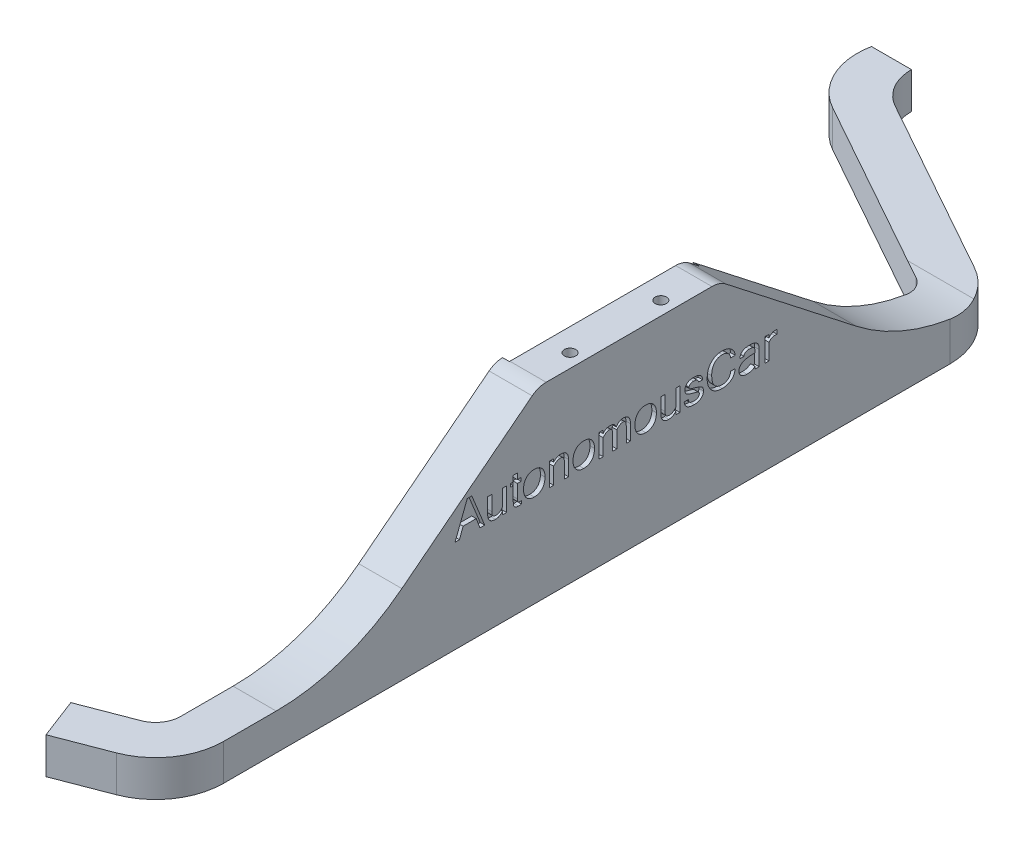
from build123d import *

# Parameters (mm, degrees)
BOSS_EXTRU_2_DEPTH      = 41
ENL_V_START             = -61.496999
ENL_V_MAT_EXTRU_1_DEPTH = 61.496999
ESQUISSE3_R             = 1.25
ENL_V_MAT_EXTRU_2_DEPTH = 5
ENL_V_MAT_EXTRU_4_REACH = 145.004
ESQUISSE5_W             = 1.5
ESQUISSE5_H             = 42
ESQUISSE4_R             = 1.25
ENL_V_MAT_EXTRU_3_DEPTH = 5
ENL_V_MAT_EXTRU_5_DEPTH = 1
ESQUISSE8_RX            = 2
ESQUISSE8_RY            = 1.909090909
ESQUISSE8_RX_2          = 2.047405919
ESQUISSE8_RY_2          = 1.246821368
ENL_V_MAT_EXTRU_6_DEPTH = 1


with BuildPart() as part:
    # Esquisse1 → Boss.-Extru.2 (new body)
    with BuildSketch(Plane(origin=(0, 0, 0), x_dir=(1, 0, 0), z_dir=(0, 1, 0))):
        with BuildLine():
            Line((50.763559857, -98.740960781), (61.966654671, -94.440883272))
            ThreePointArc((61.966654671, -94.440883272), (64.531491929, -92.419022685), (65.5, -89.3))
            Line((65.5, -89.3), (65.5, 70.7))
            ThreePointArc((65.5, 70.7), (64.743593506, 73.483580545), (62.682428855, 75.501518035))
            Line((62.682428855, 75.501518035), (21.187286271, 98.683304924))
            ThreePointArc((21.187286271, 98.683304924), (14.89615211, 105.465379036), (13.780150118, 114.648485147))
            Line((13.780150118, 114.648485147), (22.592211018, 114.648485147))
            ThreePointArc((22.592211018, 114.648485147), (23.967495552, 109.587429612), (27.715067645, 105.918452357))
            Line((27.715067645, 105.918452357), (67.31571506, 83.795049185))
            ThreePointArc((67.31571506, 83.795049185), (72.937073199, 78.291583303), (75, 70.7))
            Line((75, 70.7), (75, -89.3))
            ThreePointArc((75, -89.3), (72.360609576, -97.8), (65.370882699, -103.31))
            Line((65.370882699, -103.31), (54.167787884, -107.610077509))
            Line((54.167787884, -107.610077509), (50.763559857, -98.740960781))
        make_face()
    extrude(amount=BOSS_EXTRU_2_DEPTH)

    # Esquisse2 → Enlèv. mat.-Extru.1 (cut)
    with BuildSketch(Plane(origin=(75, 0, 0), x_dir=(0, 0, -1), z_dir=(1, 0, 0)).offset(ENL_V_START)):
        with BuildLine():
            Line((-107.610077509, 8), (-77.729988546, 8))
            ThreePointArc((-77.729988546, 8), (-63.08996569, 10.448034936), (-50.042800053, 17.525789743))
            Line((-50.042800053, 17.525789743), (-21.322570174, 39.941578917))
            ThreePointArc((-21.322570174, 39.941578917), (-19.872885103, 40.727996118), (-18.246215897, 41))
            Line((-18.246215897, 41), (18.279747735, 41))
            ThreePointArc((18.279747735, 41), (19.906416941, 40.727996118), (21.356102012, 39.941578917))
            Line((21.356102012, 39.941578917), (50.076331892, 17.525789743))
            ThreePointArc((50.076331892, 17.525789743), (63.123497529, 10.448034936), (77.763520385, 8))
            Line((77.763520385, 8), (114.648485147, 8))
            Line((114.648485147, 8), (114.648485147, 51.491997176))
            Line((114.648485147, 51.491997176), (-107.610077509, 51.491997176))
            Line((-107.610077509, 51.491997176), (-107.610077509, 8))
        make_face()
    extrude(amount=ENL_V_MAT_EXTRU_1_DEPTH, mode=Mode.SUBTRACT)

    # Esquisse3 → Enlèv. mat.-Extru.2 (cut)
    with BuildSketch(Plane.XZ):
        with Locations(Location((72, 11.001514853, 0), (0, 0, 270))):
            Circle(ESQUISSE3_R)
        with Locations(Location((72, -39.078485147, 0), (0, 0, 270))):
            Circle(ESQUISSE3_R)
        with Locations(Location((63.03, 98.921514853, 0), (0, 0, 270))):
            Circle(ESQUISSE3_R)
        with Locations(Location((65.848788278, -79.175234258, 0), (0, 0, 270))):
            Circle(ESQUISSE3_R)
        with Locations(Location((26.642211018, -101.078485147, 0), (0, 0, 270))):
            Circle(ESQUISSE3_R)
        with Locations(Location((72, 61.081514853, 0), (0, 0, 270))):
            Circle(ESQUISSE3_R)
    extrude(amount=-ENL_V_MAT_EXTRU_2_DEPTH, mode=Mode.SUBTRACT)

    # Enlèv. mat.-Extru.4: up to this face of the body (flat: up to its plane)
    enl_v_mat_extru_4_end = Plane(part.part.faces().sort_by_distance((70.25, 41, -0.016765919))[0])
    # Esquisse5 → Enlèv. mat.-Extru.4 (cut, up to the picked face)
    with BuildSketch(Plane.XZ, mode=Mode.PRIVATE) as enl_v_mat_extru_4_sk1:
        with Locations((66.25, -2.648485147)):
            Rectangle(ESQUISSE5_W, ESQUISSE5_H)
    enl_v_mat_extru_4_tool1 = split(extrude(enl_v_mat_extru_4_sk1.sketch, amount=-ENL_V_MAT_EXTRU_4_REACH, mode=Mode.PRIVATE), bisect_by=enl_v_mat_extru_4_end, keep=Keep.BOTH, mode=Mode.PRIVATE)
    add(enl_v_mat_extru_4_tool1.solids().sort_by(Axis((66.25, 0, -2.648485), (0, 1, 0)))[0], mode=Mode.SUBTRACT)

    # Esquisse4 → Enlèv. mat.-Extru.3 (cut)
    with BuildSketch(Plane(origin=(0, 41, 0), x_dir=(1, 0, 0), z_dir=(0, 1, 0))):
        with Locations(Location((72, 10.016765919, 0), (0, 0, 270))):
            Circle(ESQUISSE4_R)
        with Locations(Location((72, -9.983234081, 0), (0, 0, 90))):
            Circle(ESQUISSE4_R)
    extrude(amount=-ENL_V_MAT_EXTRU_3_DEPTH, mode=Mode.SUBTRACT)

    # Esquisse7 → Enlèv. mat.-Extru.5 (cut)
    # profile 1 of 13: a face of its own
    with BuildSketch(Plane(origin=(75, 0, 0), x_dir=(0, 0, -1), z_dir=(1, 0, 0))):
        Polygon((-31.777547707, 20.5), (-32.828684071, 20.5), (-33.656809071, 22.681818182), (-36.555956798, 22.681818182), (-37.341468162, 20.5), (-38.323002252, 20.5), (-35.632661343, 27.5), (-34.634081798, 27.5), align=None)
        Polygon((-33.930956798, 23.409090909), (-35.14402498, 26.606534091), (-36.294593162, 23.409090909), align=None, mode=Mode.SUBTRACT)
    # profile 2 of 13: a face of its own
    with BuildSketch(Plane(origin=(75, 0, 0), x_dir=(0, 0, -1), z_dir=(1, 0, 0))):
        with BuildLine():
            add(Edge.make_bspline(
                [(-27.868456798, 21.171875), (-27.925128165, 21.111107173), (-28.035633549, 20.992613966), (-28.215593571, 20.837728714), (-28.399901536, 20.705758003), (-28.588986373, 20.596313907), (-28.785501819, 20.513639299), (-28.986510447, 20.454158924), (-29.192677339, 20.414718249), (-29.332292665, 20.410974686), (-29.402547707, 20.409090909)],
                knots=[0, 0, 0, 0, 1.127828388, 2.199190093, 3.218086356, 4.203140575, 5.159827852, 6.105909572, 7.046885413, 8, 8, 8, 8], degree=3))
            add(Edge.make_bspline(
                [(-29.402547707, 20.409090909), (-29.472701093, 20.41019445), (-29.609139026, 20.412340673), (-29.806543574, 20.436351193), (-29.990931329, 20.470415644), (-30.16157157, 20.521673499), (-30.318055654, 20.589205739), (-30.463234951, 20.668035048), (-30.593109645, 20.76419223), (-30.709691657, 20.874745181), (-30.811648331, 21.000190272), (-30.901063025, 21.139442754), (-30.974662991, 21.294438415), (-31.035048056, 21.463565137), (-31.083946042, 21.646811827), (-31.117353391, 21.845088905), (-31.136982907, 22.057839578), (-31.139758511, 22.204502826), (-31.141184071, 22.279829545)],
                knots=[0, 0, 0, 0, 1.149030253, 2.23469346, 3.254265501, 4.218948563, 5.147116777, 6.043205733, 6.920039969, 7.787208019, 8.669450004, 9.562712599, 10.492792392, 11.474580383, 12.502210548, 13.596710759, 14.765662847, 16, 16, 16, 16], degree=3))
            Line((-31.141184071, 22.279829545), (-31.141184071, 25.590909091))
            Line((-31.141184071, 25.590909091), (-30.232093162, 25.590909091))
            Line((-30.232093162, 25.590909091), (-30.232093162, 22.305397727))
            add(Edge.make_bspline(
                [(-30.232093162, 22.305397727), (-30.23188718, 22.255175928), (-30.231490164, 22.158376495), (-30.218946958, 22.018619986), (-30.203139232, 21.889864126), (-30.178813744, 21.772077364), (-30.147683737, 21.665115704), (-30.110223774, 21.568477183), (-30.064022453, 21.483309068), (-30.011290098, 21.40870429), (-29.95060024, 21.34315897), (-29.880084839, 21.287358713), (-29.800004758, 21.240656847), (-29.711264955, 21.202231764), (-29.614037158, 21.172527131), (-29.507946767, 21.151390174), (-29.392446269, 21.13856742), (-29.312146835, 21.137116917), (-29.270445434, 21.136363636)],
                knots=[0, 0, 0, 0, 1.373336941, 2.647022626, 3.836014541, 4.920805023, 5.933267669, 6.881014996, 7.750458455, 8.577164573, 9.374527885, 10.185764868, 11.027755585, 11.903736305, 12.825636, 13.803704939, 14.859411894, 16, 16, 16, 16], degree=3))
            add(Edge.make_bspline(
                [(-29.270445434, 21.136363636), (-29.207288968, 21.138849429), (-29.080763147, 21.143829394), (-28.893716866, 21.183486664), (-28.711553594, 21.248928606), (-28.532329063, 21.337131469), (-28.359171231, 21.454010551), (-28.188797496, 21.59465979), (-28.022733105, 21.760664355), (-27.920861096, 21.885874401), (-27.868456798, 21.950284091)],
                knots=[0, 0, 0, 0, 0.901713362, 1.806466215, 2.717870271, 3.661706435, 4.65228247, 5.695064889, 6.814311147, 8, 8, 8, 8], degree=3))
            Line((-27.868456798, 21.950284091), (-27.868456798, 25.590909091))
            Line((-27.868456798, 25.590909091), (-26.959365889, 25.590909091))
            Line((-26.959365889, 25.590909091), (-26.959365889, 20.5))
            Line((-26.959365889, 20.5), (-27.868456798, 20.5))
            Line((-27.868456798, 20.5), (-27.868456798, 21.171875))
        make_face()
    # profile 3 of 13: a face of its own
    with BuildSketch(Plane(origin=(75, 0, 0), x_dir=(0, 0, -1), z_dir=(1, 0, 0))):
        with BuildLine():
            add(Edge.make_bspline(
                [(-23.686638616, 20.46875), (-23.788211897, 20.451702758), (-23.999324003, 20.416271401), (-24.213364461, 20.411543865), (-24.324422707, 20.409090909)],
                knots=[0, 0, 0, 0, 0.962268651, 2, 2, 2, 2], degree=3))
            add(Edge.make_bspline(
                [(-24.324422707, 20.409090909), (-24.368478314, 20.409472288), (-24.45387086, 20.41021151), (-24.577157317, 20.420511601), (-24.691441205, 20.436060844), (-24.796695961, 20.456485682), (-24.892509686, 20.485316108), (-24.979497764, 20.519380192), (-25.058498564, 20.558374577), (-25.148050344, 20.621130725), (-25.244512177, 20.710573252), (-25.338017162, 20.833326093), (-25.406380646, 20.971293442), (-25.448144696, 21.125874883), (-25.473522922, 21.29999547), (-25.491191916, 21.498746282), (-25.502440278, 21.725252476), (-25.503996642, 21.885402246), (-25.504820434, 21.970170455)],
                knots=[0, 0, 0, 0, 0.915506075, 1.774516358, 2.569274487, 3.312384989, 4.000542567, 4.64569235, 5.253104346, 5.826388329, 6.91283513, 7.973796641, 9.01694262, 10.091691676, 11.287428953, 12.671219085, 14.238056834, 16, 16, 16, 16], degree=3))
            Line((-25.504820434, 21.970170455), (-25.504820434, 24.863636364))
            Line((-25.504820434, 24.863636364), (-26.141184071, 24.863636364))
            Line((-26.141184071, 24.863636364), (-26.141184071, 25.590909091))
            Line((-26.141184071, 25.590909091), (-25.504820434, 25.590909091))
            Line((-25.504820434, 25.590909091), (-25.504820434, 26.863636364))
            Line((-25.504820434, 26.863636364), (-24.595729525, 26.863636364))
            Line((-24.595729525, 26.863636364), (-24.595729525, 25.590909091))
            Line((-24.595729525, 25.590909091), (-23.777547707, 25.590909091))
            Line((-23.777547707, 25.590909091), (-23.777547707, 24.863636364))
            Line((-23.777547707, 24.863636364), (-24.595729525, 24.863636364))
            Line((-24.595729525, 24.863636364), (-24.595729525, 21.938920455))
            add(Edge.make_bspline(
                [(-24.595729525, 21.938920455), (-24.59577158, 21.89723895), (-24.595851461, 21.818066373), (-24.588003718, 21.705332678), (-24.578226578, 21.604917392), (-24.566717774, 21.515780834), (-24.547540569, 21.43917578), (-24.527404382, 21.373417695), (-24.501892794, 21.319490272), (-24.462189728, 21.26472458), (-24.401303885, 21.212845015), (-24.317708378, 21.168703926), (-24.222542912, 21.140097249), (-24.155131598, 21.137645721), (-24.119877252, 21.136363636)],
                knots=[0, 0, 0, 0, 1.398848829, 2.657065015, 3.791080445, 4.786898287, 5.669749782, 6.438810766, 7.092827035, 7.661947346, 8.698173471, 9.743502783, 10.819911231, 12, 12, 12, 12], degree=3))
            add(Edge.make_bspline(
                [(-24.119877252, 21.136363636), (-24.045865127, 21.138016578), (-23.900599646, 21.141260849), (-23.757050233, 21.163706311), (-23.686638616, 21.174715909)],
                knots=[0, 0, 0, 0, 1.018991225, 2, 2, 2, 2], degree=3))
            Line((-23.686638616, 21.174715909), (-23.686638616, 20.46875))
        make_face()
    # profile 4 of 13: a face of its own
    with BuildSketch(Plane(origin=(75, 0, 0), x_dir=(0, 0, -1), z_dir=(1, 0, 0))):
        with BuildLine():
            add(Edge.make_bspline(
                [(-20.871297707, 25.681818182), (-20.783618239, 25.679459525), (-20.611954133, 25.674841604), (-20.361088523, 25.643898891), (-20.124118439, 25.589885689), (-19.90093326, 25.514097318), (-19.690547304, 25.417897466), (-19.495494825, 25.296831807), (-19.311824995, 25.157523512), (-19.144486148, 24.99501663), (-18.993797968, 24.813201342), (-18.862503236, 24.613015071), (-18.751197811, 24.395395205), (-18.659793626, 24.159908426), (-18.591597333, 23.905758339), (-18.539796702, 23.634814174), (-18.510309923, 23.345825329), (-18.506682084, 23.147319279), (-18.504820434, 23.045454545)],
                knots=[0, 0, 0, 0, 1.049034325, 2.05386214, 3.018604366, 3.951981618, 4.869545413, 5.779945843, 6.693214847, 7.622715751, 8.564223993, 9.513269582, 10.481133853, 11.48373939, 12.529648482, 13.62517997, 14.7813449, 16, 16, 16, 16], degree=3))
            add(Edge.make_bspline(
                [(-18.504820434, 23.045454545), (-18.506656393, 22.943586805), (-18.510225677, 22.745545921), (-18.539960245, 22.457065049), (-18.591368701, 22.186986963), (-18.660008913, 21.93341235), (-18.75155446, 21.698073574), (-18.862079941, 21.479562761), (-18.993870665, 21.279185932), (-19.144384724, 21.097186605), (-19.312360243, 20.935043976), (-19.494582495, 20.793707157), (-19.691024772, 20.674668203), (-19.901149953, 20.578500911), (-20.123827207, 20.500615814), (-20.361128389, 20.447134921), (-20.611943477, 20.416034149), (-20.783614637, 20.411438296), (-20.871297707, 20.409090909)],
                knots=[0, 0, 0, 0, 1.218937572, 2.369734242, 3.465519663, 4.50620902, 5.509046951, 6.482180439, 7.431446007, 8.373172481, 9.302888835, 10.219825273, 11.127487668, 12.045264145, 12.980695951, 13.945661796, 14.950722519, 16, 16, 16, 16], degree=3))
            add(Edge.make_bspline(
                [(-20.871297707, 20.409090909), (-20.958506593, 20.411441455), (-21.129232662, 20.416043044), (-21.37865236, 20.447091794), (-21.61491948, 20.500856219), (-21.837204137, 20.578460205), (-22.047253514, 20.674744111), (-22.243632542, 20.793251495), (-22.424632136, 20.935550917), (-22.592581135, 21.097119048), (-22.743028738, 21.279204277), (-22.874837573, 21.479557696), (-22.98535804, 21.69807499), (-23.076904992, 21.93341195), (-23.145544806, 22.186987078), (-23.196953376, 22.457065016), (-23.226687912, 22.74554593), (-23.230257201, 22.943586808), (-23.232093162, 23.045454545)],
                knots=[0, 0, 0, 0, 1.045006319, 2.045775724, 3.006496687, 3.943174395, 4.862173258, 5.771044569, 6.684720645, 7.615675288, 8.558656048, 9.509185943, 10.483615548, 11.487789159, 12.529864611, 13.627109509, 14.779438925, 16, 16, 16, 16], degree=3))
            add(Edge.make_bspline(
                [(-23.232093162, 23.045454545), (-23.230231509, 23.147319276), (-23.226603666, 23.34582532), (-23.19711692, 23.634814207), (-23.145316175, 23.905758224), (-23.077120277, 24.159908828), (-22.985714703, 24.395393793), (-22.874414213, 24.613020104), (-22.74310159, 24.813183001), (-22.592479133, 24.995084157), (-22.425170127, 25.157015174), (-22.242719274, 25.29729146), (-22.047731507, 25.417821525), (-21.837420721, 25.514138235), (-21.614629229, 25.589648257), (-21.378691883, 25.643940988), (-21.129222094, 25.674832975), (-20.95850302, 25.679456454), (-20.871297707, 25.681818182)],
                knots=[0, 0, 0, 0, 1.220279149, 2.377984851, 3.474976307, 4.522279238, 5.526220904, 6.495375006, 7.445685348, 8.388448298, 9.319187909, 10.229176357, 11.140790039, 12.059576632, 12.994197755, 13.95469681, 14.955235057, 16, 16, 16, 16], degree=3))
        make_face()
        with BuildLine():
            add(Edge.make_bspline(
                [(-20.868456798, 21.136363636), (-20.815815304, 21.137571292), (-20.712385605, 21.139944087), (-20.560875387, 21.163316899), (-20.417064793, 21.201541072), (-20.280958504, 21.254718178), (-20.15213507, 21.321299506), (-20.031841318, 21.404868844), (-19.919650333, 21.503672976), (-19.81387605, 21.615985599), (-19.718406702, 21.743549163), (-19.63778868, 21.887499863), (-19.567777134, 22.044216378), (-19.511080907, 22.216041725), (-19.467383386, 22.40242758), (-19.437184304, 22.603400285), (-19.416088958, 22.818208776), (-19.414651621, 22.96632749), (-19.413911343, 23.042613636)],
                knots=[0, 0, 0, 0, 0.932839246, 1.832837115, 2.710552587, 3.566476241, 4.418892928, 5.275886436, 6.156488082, 7.0652537, 8.007228511, 8.973580228, 9.984560426, 11.046509435, 12.17668714, 13.37476731, 14.647916404, 16, 16, 16, 16], degree=3))
            add(Edge.make_bspline(
                [(-19.413911343, 23.042613636), (-19.414648045, 23.119373931), (-19.416078686, 23.268439042), (-19.437233349, 23.484651129), (-19.467169704, 23.686631094), (-19.511376175, 23.873823733), (-19.567457381, 24.046325824), (-19.637822153, 24.20339915), (-19.718399649, 24.347359462), (-19.813872439, 24.474934522), (-19.919670398, 24.587194679), (-20.031767872, 24.686188663), (-20.152583705, 24.769198048), (-20.280214597, 24.838308445), (-20.417464128, 24.888842048), (-20.560810265, 24.927750113), (-20.712402757, 24.950923411), (-20.81582109, 24.95332377), (-20.868456798, 24.954545455)],
                knots=[0, 0, 0, 0, 1.357598019, 2.636395568, 3.840219106, 4.968005622, 6.035658851, 7.044500053, 8.008807198, 8.948789013, 9.855631897, 10.734370398, 11.589550711, 12.444074203, 13.295182303, 14.171040735, 15.069134422, 16, 16, 16, 16], degree=3))
            add(Edge.make_bspline(
                [(-20.868456798, 24.954545455), (-20.921092506, 24.95332377), (-21.024510839, 24.950923411), (-21.176103331, 24.927750113), (-21.319449468, 24.888842048), (-21.456698999, 24.838308445), (-21.584329891, 24.769198048), (-21.705145724, 24.686188663), (-21.817243198, 24.587194679), (-21.923041157, 24.474934522), (-22.018513947, 24.347359462), (-22.099091443, 24.20339915), (-22.169456214, 24.046325824), (-22.225537421, 23.873823733), (-22.269743892, 23.686631094), (-22.299680247, 23.484651129), (-22.320834909, 23.268439042), (-22.322265551, 23.119373931), (-22.323002252, 23.042613636)],
                knots=[0, 0, 0, 0, 0.930865578, 1.828959265, 2.704817697, 3.555925797, 4.410449289, 5.265629602, 6.144368103, 7.051210987, 7.991192802, 8.955499947, 9.964341149, 11.031994378, 12.159780894, 13.363604432, 14.642401981, 16, 16, 16, 16], degree=3))
            add(Edge.make_bspline(
                [(-22.323002252, 23.042613636), (-22.322261975, 22.96632749), (-22.320824638, 22.818208776), (-22.299729291, 22.603400285), (-22.26953021, 22.40242758), (-22.225832689, 22.216041725), (-22.169136462, 22.044216378), (-22.099124916, 21.887499863), (-22.018506894, 21.743549163), (-21.923037546, 21.615985599), (-21.817263263, 21.503672976), (-21.705072278, 21.404868844), (-21.584778526, 21.321299506), (-21.455955092, 21.254718178), (-21.319848803, 21.201541072), (-21.176038208, 21.163316899), (-21.024527991, 21.139944087), (-20.921098291, 21.137571292), (-20.868456798, 21.136363636)],
                knots=[0, 0, 0, 0, 1.352083596, 2.62523269, 3.82331286, 4.953490565, 6.015439574, 7.026419772, 7.992771489, 8.9347463, 9.843511918, 10.724113564, 11.581107072, 12.433523759, 13.289447413, 14.167162885, 15.067160754, 16, 16, 16, 16], degree=3))
        make_face(mode=Mode.SUBTRACT)
    # profile 5 of 13: a face of its own
    with BuildSketch(Plane(origin=(75, 0, 0), x_dir=(0, 0, -1), z_dir=(1, 0, 0))):
        with BuildLine():
            add(Edge.make_bspline(
                [(-16.595729525, 24.921875), (-16.538998209, 24.982120762), (-16.428154701, 25.099830911), (-16.248512022, 25.254413097), (-16.064562325, 25.387470085), (-15.873557817, 25.493202012), (-15.678777487, 25.579407765), (-15.477749884, 25.638440396), (-15.271366482, 25.6757743), (-15.131873615, 25.679794168), (-15.061638616, 25.681818182)],
                knots=[0, 0, 0, 0, 1.124155824, 2.19641258, 3.216160061, 4.20447108, 5.158577312, 6.10544942, 7.04608915, 8, 8, 8, 8], degree=3))
            add(Edge.make_bspline(
                [(-15.061638616, 25.681818182), (-14.991485243, 25.680712923), (-14.855047335, 25.678563358), (-14.65764261, 25.654576365), (-14.472809236, 25.620347594), (-14.30234376, 25.569350346), (-14.145039197, 25.503370327), (-14.001405531, 25.422542492), (-13.870935433, 25.32689682), (-13.755062401, 25.216156031), (-13.651638734, 25.091873847), (-13.563456076, 24.951660344), (-13.49024308, 24.796547909), (-13.426585651, 24.62895216), (-13.380920306, 24.445197495), (-13.346737752, 24.247762304), (-13.327192541, 24.035427884), (-13.324427148, 23.889243406), (-13.323002252, 23.813920455)],
                knots=[0, 0, 0, 0, 1.149943122, 2.236468855, 3.256850915, 4.229735766, 5.148458424, 6.049050432, 6.926581285, 7.794438274, 8.671384828, 9.571909874, 10.502728587, 11.480682835, 12.507163291, 13.602533048, 14.764682204, 16, 16, 16, 16], degree=3))
            Line((-13.323002252, 23.813920455), (-13.323002252, 20.5))
            Line((-13.323002252, 20.5), (-14.232093162, 20.5))
            Line((-14.232093162, 20.5), (-14.232093162, 23.785511364))
            add(Edge.make_bspline(
                [(-14.232093162, 23.785511364), (-14.232283796, 23.835736316), (-14.232651232, 23.932541827), (-14.24539944, 24.072256214), (-14.260521854, 24.201253487), (-14.287183984, 24.318661753), (-14.317946676, 24.425740011), (-14.355039175, 24.52289907), (-14.403324047, 24.607130866), (-14.455558411, 24.682781504), (-14.517904335, 24.747261433), (-14.588275608, 24.803629244), (-14.668466797, 24.850234406), (-14.757179433, 24.888664352), (-14.854841773, 24.918595338), (-14.961483034, 24.939346249), (-15.076944096, 24.952322196), (-15.156772825, 24.953788267), (-15.198002252, 24.954545455)],
                knots=[0, 0, 0, 0, 1.371827898, 2.644114037, 3.83179947, 4.918098577, 5.929448714, 6.876154642, 7.750885757, 8.576683478, 9.382055027, 10.19240061, 11.033466135, 11.908484314, 12.829371012, 13.819050132, 14.87359706, 16, 16, 16, 16], degree=3))
            add(Edge.make_bspline(
                [(-15.198002252, 24.954545455), (-15.256442627, 24.952037378), (-15.374555275, 24.946968356), (-15.550959525, 24.906460982), (-15.726474792, 24.841470458), (-15.902919634, 24.75278574), (-16.077159974, 24.635921589), (-16.253079867, 24.495959397), (-16.427378321, 24.329050745), (-16.53833621, 24.204862011), (-16.595729525, 24.140625)],
                knots=[0, 0, 0, 0, 0.840281211, 1.698275214, 2.590640667, 3.529127209, 4.532563541, 5.604079008, 6.760702381, 8, 8, 8, 8], degree=3))
            Line((-16.595729525, 24.140625), (-16.595729525, 20.5))
            Line((-16.595729525, 20.5), (-17.504820434, 20.5))
            Line((-17.504820434, 20.5), (-17.504820434, 25.590909091))
            Line((-17.504820434, 25.590909091), (-16.595729525, 25.590909091))
            Line((-16.595729525, 25.590909091), (-16.595729525, 24.921875))
        make_face()
    # profile 6 of 13: a face of its own
    with BuildSketch(Plane(origin=(75, 0, 0), x_dir=(0, 0, -1), z_dir=(1, 0, 0))):
        with BuildLine():
            add(Edge.make_bspline(
                [(-9.962206798, 25.681818182), (-9.87452733, 25.679459525), (-9.702863224, 25.674841604), (-9.451997614, 25.643898891), (-9.215027529, 25.589885689), (-8.991842351, 25.514097318), (-8.781456394, 25.417897466), (-8.586403915, 25.296831807), (-8.402734086, 25.157523512), (-8.235395239, 24.99501663), (-8.084707059, 24.813201342), (-7.953412327, 24.613015071), (-7.842106902, 24.395395205), (-7.750702717, 24.159908426), (-7.682506424, 23.905758339), (-7.630705793, 23.634814174), (-7.601219014, 23.345825329), (-7.597591175, 23.147319279), (-7.595729525, 23.045454545)],
                knots=[0, 0, 0, 0, 1.049034325, 2.05386214, 3.018604366, 3.951981618, 4.869545413, 5.779945843, 6.693214847, 7.622715751, 8.564223993, 9.513269582, 10.481133853, 11.48373939, 12.529648482, 13.62517997, 14.7813449, 16, 16, 16, 16], degree=3))
            add(Edge.make_bspline(
                [(-7.595729525, 23.045454545), (-7.597565484, 22.943586805), (-7.601134768, 22.745545921), (-7.630869336, 22.457065049), (-7.682277792, 22.186986963), (-7.750918004, 21.93341235), (-7.842463551, 21.698073574), (-7.952989032, 21.479562761), (-8.084779756, 21.279185932), (-8.235293815, 21.097186605), (-8.403269334, 20.935043976), (-8.585491586, 20.793707157), (-8.781933862, 20.674668203), (-8.992059044, 20.578500911), (-9.214736298, 20.500615814), (-9.45203748, 20.447134921), (-9.702852568, 20.416034149), (-9.874523727, 20.411438296), (-9.962206798, 20.409090909)],
                knots=[0, 0, 0, 0, 1.218937572, 2.369734242, 3.465519663, 4.50620902, 5.509046951, 6.482180439, 7.431446007, 8.373172481, 9.302888835, 10.219825273, 11.127487668, 12.045264145, 12.980695951, 13.945661796, 14.950722519, 16, 16, 16, 16], degree=3))
            add(Edge.make_bspline(
                [(-9.962206798, 20.409090909), (-10.049415683, 20.411441455), (-10.220141752, 20.416043044), (-10.469561451, 20.447091794), (-10.705828571, 20.500856219), (-10.928113228, 20.578460205), (-11.138162605, 20.674744111), (-11.334541633, 20.793251495), (-11.515541227, 20.935550917), (-11.683490226, 21.097119048), (-11.833937829, 21.279204277), (-11.965746664, 21.479557696), (-12.076267131, 21.69807499), (-12.167814083, 21.93341195), (-12.236453897, 22.186987078), (-12.287862467, 22.457065016), (-12.317597003, 22.74554593), (-12.321166291, 22.943586808), (-12.323002252, 23.045454545)],
                knots=[0, 0, 0, 0, 1.045006319, 2.045775724, 3.006496687, 3.943174395, 4.862173258, 5.771044569, 6.684720645, 7.615675288, 8.558656048, 9.509185943, 10.483615548, 11.487789159, 12.529864611, 13.627109509, 14.779438925, 16, 16, 16, 16], degree=3))
            add(Edge.make_bspline(
                [(-12.323002252, 23.045454545), (-12.3211406, 23.147319276), (-12.317512757, 23.34582532), (-12.28802601, 23.634814207), (-12.236225265, 23.905758224), (-12.168029368, 24.159908828), (-12.076623794, 24.395393793), (-11.965323303, 24.613020104), (-11.834010681, 24.813183001), (-11.683388224, 24.995084157), (-11.516079218, 25.157015174), (-11.333628365, 25.29729146), (-11.138640598, 25.417821525), (-10.928329812, 25.514138235), (-10.70553832, 25.589648257), (-10.469600974, 25.643940988), (-10.220131185, 25.674832975), (-10.049412111, 25.679456454), (-9.962206798, 25.681818182)],
                knots=[0, 0, 0, 0, 1.220279149, 2.377984851, 3.474976307, 4.522279238, 5.526220904, 6.495375006, 7.445685348, 8.388448298, 9.319187909, 10.229176357, 11.140790039, 12.059576632, 12.994197755, 13.95469681, 14.955235057, 16, 16, 16, 16], degree=3))
        make_face()
        with BuildLine():
            add(Edge.make_bspline(
                [(-9.959365889, 21.136363636), (-9.906724395, 21.137571292), (-9.803294696, 21.139944087), (-9.651784478, 21.163316899), (-9.507973884, 21.201541072), (-9.371867595, 21.254718178), (-9.243044161, 21.321299506), (-9.122750408, 21.404868844), (-9.010559423, 21.503672976), (-8.904785141, 21.615985599), (-8.809315793, 21.743549163), (-8.728697771, 21.887499863), (-8.658686225, 22.044216378), (-8.601989998, 22.216041725), (-8.558292477, 22.40242758), (-8.528093395, 22.603400285), (-8.506998049, 22.818208776), (-8.505560711, 22.96632749), (-8.504820434, 23.042613636)],
                knots=[0, 0, 0, 0, 0.932839246, 1.832837115, 2.710552587, 3.566476241, 4.418892928, 5.275886436, 6.156488082, 7.0652537, 8.007228511, 8.973580228, 9.984560426, 11.046509435, 12.17668714, 13.37476731, 14.647916404, 16, 16, 16, 16], degree=3))
            add(Edge.make_bspline(
                [(-8.504820434, 23.042613636), (-8.505557136, 23.119373931), (-8.506987777, 23.268439042), (-8.52814244, 23.484651129), (-8.558078795, 23.686631094), (-8.602285266, 23.873823733), (-8.658366472, 24.046325824), (-8.728731244, 24.20339915), (-8.80930874, 24.347359462), (-8.90478153, 24.474934522), (-9.010579489, 24.587194679), (-9.122676963, 24.686188663), (-9.243492796, 24.769198048), (-9.371123688, 24.838308445), (-9.508373218, 24.888842048), (-9.651719356, 24.927750113), (-9.803311848, 24.950923411), (-9.906730181, 24.95332377), (-9.959365889, 24.954545455)],
                knots=[0, 0, 0, 0, 1.357598019, 2.636395568, 3.840219106, 4.968005622, 6.035658851, 7.044500053, 8.008807198, 8.948789013, 9.855631897, 10.734370398, 11.589550711, 12.444074203, 13.295182303, 14.171040735, 15.069134422, 16, 16, 16, 16], degree=3))
            add(Edge.make_bspline(
                [(-9.959365889, 24.954545455), (-10.012001597, 24.95332377), (-10.11541993, 24.950923411), (-10.267012422, 24.927750113), (-10.410358559, 24.888842048), (-10.54760809, 24.838308445), (-10.675238982, 24.769198048), (-10.796054815, 24.686188663), (-10.908152289, 24.587194679), (-11.013950248, 24.474934522), (-11.109423037, 24.347359462), (-11.190000534, 24.20339915), (-11.260365305, 24.046325824), (-11.316446512, 23.873823733), (-11.360652982, 23.686631094), (-11.390589338, 23.484651129), (-11.411744, 23.268439042), (-11.413174642, 23.119373931), (-11.413911343, 23.042613636)],
                knots=[0, 0, 0, 0, 0.930865578, 1.828959265, 2.704817697, 3.555925797, 4.410449289, 5.265629602, 6.144368103, 7.051210987, 7.991192802, 8.955499947, 9.964341149, 11.031994378, 12.159780894, 13.363604432, 14.642401981, 16, 16, 16, 16], degree=3))
            add(Edge.make_bspline(
                [(-11.413911343, 23.042613636), (-11.413171066, 22.96632749), (-11.411733729, 22.818208776), (-11.390638382, 22.603400285), (-11.360439301, 22.40242758), (-11.31674178, 22.216041725), (-11.260045553, 22.044216378), (-11.190034007, 21.887499863), (-11.109415985, 21.743549163), (-11.013946637, 21.615985599), (-10.908172354, 21.503672976), (-10.795981369, 21.404868844), (-10.675687617, 21.321299506), (-10.546864183, 21.254718178), (-10.410757894, 21.201541072), (-10.266947299, 21.163316899), (-10.115437082, 21.139944087), (-10.012007382, 21.137571292), (-9.959365889, 21.136363636)],
                knots=[0, 0, 0, 0, 1.352083596, 2.62523269, 3.82331286, 4.953490565, 6.015439574, 7.026419772, 7.992771489, 8.9347463, 9.843511918, 10.724113564, 11.581107072, 12.433523759, 13.289447413, 14.167162885, 15.067160754, 16, 16, 16, 16], degree=3))
        make_face(mode=Mode.SUBTRACT)
    # profile 7 of 13: a face of its own
    with BuildSketch(Plane(origin=(75, 0, 0), x_dir=(0, 0, -1), z_dir=(1, 0, 0))):
        with BuildLine():
            Line((0.313361384, 20.5), (-0.595729525, 20.5))
            Line((-0.595729525, 20.5), (-0.595729525, 23.785511364))
            add(Edge.make_bspline(
                [(-0.595729525, 23.785511364), (-0.596244003, 23.836186654), (-0.597240081, 23.934298916), (-0.605688708, 24.075559473), (-0.619607132, 24.205513265), (-0.63935265, 24.323653849), (-0.664354944, 24.431287224), (-0.696986901, 24.527063511), (-0.733683286, 24.612118381), (-0.776418625, 24.686168116), (-0.827548088, 24.749326543), (-0.883879211, 24.806091395), (-0.950923325, 24.850849342), (-1.023422196, 24.890644284), (-1.105526443, 24.917738963), (-1.193743713, 24.939505121), (-1.289963683, 24.952326625), (-1.356582012, 24.95378695), (-1.391184071, 24.954545455)],
                knots=[0, 0, 0, 0, 1.493935585, 2.892403697, 4.170372235, 5.345383876, 6.422082669, 7.424162481, 8.324203399, 9.150181051, 9.935027125, 10.714891579, 11.497126258, 12.302679702, 13.145935184, 14.036398611, 14.98009076, 16, 16, 16, 16], degree=3))
            add(Edge.make_bspline(
                [(-1.391184071, 24.954545455), (-1.446329388, 24.952067667), (-1.557462941, 24.947074217), (-1.723014771, 24.906274372), (-1.886895409, 24.841587782), (-2.050804203, 24.75227537), (-2.212104666, 24.635932758), (-2.373778882, 24.495278034), (-2.533874215, 24.328920438), (-2.634525204, 24.204859322), (-2.686638616, 24.140625)],
                knots=[0, 0, 0, 0, 0.835193023, 1.683152312, 2.569615213, 3.501144871, 4.505013219, 5.578725089, 6.746352143, 8, 8, 8, 8], degree=3))
            Line((-2.686638616, 24.140625), (-2.686638616, 20.5))
            Line((-2.686638616, 20.5), (-3.595729525, 20.5))
            Line((-3.595729525, 20.5), (-3.595729525, 23.785511364))
            add(Edge.make_bspline(
                [(-3.595729525, 23.785511364), (-3.596244002, 23.836186655), (-3.59724008, 23.934298917), (-3.60568871, 24.07555947), (-3.619607127, 24.205513275), (-3.639352668, 24.323653816), (-3.664354887, 24.431287332), (-3.696987089, 24.527063153), (-3.733682684, 24.612119528), (-3.776420632, 24.686164292), (-3.827541008, 24.74934003), (-3.883905533, 24.806041258), (-3.951172912, 24.851274493), (-4.024568962, 24.890271529), (-4.106911896, 24.91779783), (-4.195625312, 24.939642693), (-4.292813322, 24.952299646), (-4.360371582, 24.953777964), (-4.395445434, 24.954545455)],
                knots=[0, 0, 0, 0, 1.490196267, 2.885164016, 4.159933801, 5.33200439, 6.406008208, 7.405579816, 8.303367934, 9.127278165, 9.91015977, 10.688072226, 11.468348973, 12.284218556, 13.125363372, 14.01359797, 14.96873054, 16, 16, 16, 16], degree=3))
            add(Edge.make_bspline(
                [(-4.395445434, 24.954545455), (-4.45058987, 24.952066451), (-4.561721648, 24.94707055), (-4.727287155, 24.906289583), (-4.891112433, 24.841526582), (-5.054906129, 24.752708685), (-5.21500682, 24.635375815), (-5.3766231, 24.495766349), (-5.535220777, 24.328781738), (-5.634974702, 24.204824263), (-5.686638616, 24.140625)],
                knots=[0, 0, 0, 0, 0.836804897, 1.686400698, 2.574574421, 3.507901878, 4.507853353, 5.583637424, 6.748532952, 8, 8, 8, 8], degree=3))
            Line((-5.686638616, 24.140625), (-5.686638616, 20.5))
            Line((-5.686638616, 20.5), (-6.595729525, 20.5))
            Line((-6.595729525, 20.5), (-6.595729525, 25.590909091))
            Line((-6.595729525, 25.590909091), (-5.686638616, 25.590909091))
            Line((-5.686638616, 25.590909091), (-5.686638616, 24.921875))
            add(Edge.make_bspline(
                [(-5.686638616, 24.921875), (-5.633249304, 24.982089963), (-5.529135396, 25.099514496), (-5.359576076, 25.25369346), (-5.187220235, 25.386805842), (-5.00874274, 25.493031239), (-4.82713488, 25.57897762), (-4.639895637, 25.638425944), (-4.448067876, 25.675677513), (-4.318434803, 25.679766702), (-4.25339998, 25.681818182)],
                knots=[0, 0, 0, 0, 1.151393985, 2.245320666, 3.275716357, 4.26388374, 5.213153934, 6.145697202, 7.069726176, 8, 8, 8, 8], degree=3))
            add(Edge.make_bspline(
                [(-4.25339998, 25.681818182), (-4.163743736, 25.679300161), (-3.99184609, 25.674472368), (-3.746220341, 25.632186198), (-3.526663155, 25.559404616), (-3.330758069, 25.45999207), (-3.162198885, 25.327873913), (-3.017791463, 25.168226047), (-2.90144692, 24.977875195), (-2.847747995, 24.836719967), (-2.820161343, 24.764204545)],
                knots=[0, 0, 0, 0, 1.171614067, 2.246332142, 3.244689219, 4.186051071, 5.103603213, 6.028455869, 6.987162179, 8, 8, 8, 8], degree=3))
            add(Edge.make_bspline(
                [(-2.820161343, 24.764204545), (-2.778785999, 24.811812704), (-2.698732499, 24.903925525), (-2.578372351, 25.032766647), (-2.462896642, 25.148484284), (-2.352668335, 25.25116516), (-2.246204266, 25.339068876), (-2.145324015, 25.414051086), (-2.048518308, 25.473750461), (-1.92807782, 25.536186498), (-1.77945525, 25.591872784), (-1.60435053, 25.645052197), (-1.429672652, 25.675781555), (-1.313642306, 25.679820215), (-1.256240889, 25.681818182)],
                knots=[0, 0, 0, 0, 1.208135797, 2.33751524, 3.376454134, 4.339203868, 5.221759411, 6.019939149, 6.744829706, 7.397906675, 8.615604897, 9.777970306, 10.900738833, 12, 12, 12, 12], degree=3))
            add(Edge.make_bspline(
                [(-1.256240889, 25.681818182), (-1.192700981, 25.680747477), (-1.069446741, 25.678670533), (-0.891032383, 25.654267599), (-0.724283922, 25.620860282), (-0.570539658, 25.568043048), (-0.427794832, 25.504177573), (-0.298778951, 25.421540871), (-0.181543609, 25.3257467), (-0.075461818, 25.216408399), (0.015653253, 25.090103809), (0.097343917, 24.951458807), (0.163201083, 24.796201639), (0.219079979, 24.628197176), (0.260966242, 24.444951032), (0.292079396, 24.247572826), (0.310645384, 24.035394213), (0.312437691, 23.889242201), (0.313361384, 23.813920455)],
                knots=[0, 0, 0, 0, 1.09119232, 2.116686744, 3.090274014, 4.008954095, 4.904677686, 5.771586021, 6.63328443, 7.502328949, 8.38122346, 9.303787737, 10.262260052, 11.273579448, 12.343413727, 13.488614951, 14.705718062, 16, 16, 16, 16], degree=3))
            Line((0.313361384, 23.813920455), (0.313361384, 20.5))
        make_face()
    # profile 8 of 13: a face of its own
    with BuildSketch(Plane(origin=(75, 0, 0), x_dir=(0, 0, -1), z_dir=(1, 0, 0))):
        with BuildLine():
            add(Edge.make_bspline(
                [(3.674156838, 25.681818182), (3.761836306, 25.679459525), (3.933500412, 25.674841604), (4.184366022, 25.643898891), (4.421336107, 25.589885689), (4.644521285, 25.514097318), (4.854907242, 25.417897466), (5.049959721, 25.296831807), (5.23362955, 25.157523512), (5.400968397, 24.99501663), (5.551656577, 24.813201342), (5.68295131, 24.613015071), (5.794256734, 24.395395205), (5.885660919, 24.159908426), (5.953857212, 23.905758339), (6.005657844, 23.634814174), (6.035144623, 23.345825329), (6.038772461, 23.147319279), (6.040634111, 23.045454545)],
                knots=[0, 0, 0, 0, 1.049034325, 2.05386214, 3.018604366, 3.951981618, 4.869545413, 5.779945843, 6.693214847, 7.622715751, 8.564223993, 9.513269582, 10.481133853, 11.48373939, 12.529648482, 13.62517997, 14.7813449, 16, 16, 16, 16], degree=3))
            add(Edge.make_bspline(
                [(6.040634111, 23.045454545), (6.038798153, 22.943586805), (6.035228869, 22.745545921), (6.0054943, 22.457065049), (5.954085845, 22.186986963), (5.885445632, 21.93341235), (5.793900085, 21.698073574), (5.683374605, 21.479562761), (5.55158388, 21.279185932), (5.401069821, 21.097186605), (5.233094303, 20.935043976), (5.050872051, 20.793707157), (4.854429774, 20.674668203), (4.644304593, 20.578500911), (4.421627338, 20.500615814), (4.184326156, 20.447134921), (3.933511068, 20.416034149), (3.761839909, 20.411438296), (3.674156838, 20.409090909)],
                knots=[0, 0, 0, 0, 1.218937572, 2.369734242, 3.465519663, 4.50620902, 5.509046951, 6.482180439, 7.431446007, 8.373172481, 9.302888835, 10.219825273, 11.127487668, 12.045264145, 12.980695951, 13.945661796, 14.950722519, 16, 16, 16, 16], degree=3))
            add(Edge.make_bspline(
                [(3.674156838, 20.409090909), (3.586947953, 20.411441455), (3.416221884, 20.416043044), (3.166802185, 20.447091794), (2.930535065, 20.500856219), (2.708250409, 20.578460205), (2.498201031, 20.674744111), (2.301822003, 20.793251495), (2.120822409, 20.935550917), (1.952873411, 21.097119048), (1.802425807, 21.279204277), (1.670616972, 21.479557696), (1.560096505, 21.69807499), (1.468549554, 21.93341195), (1.399909739, 22.186987078), (1.348501169, 22.457065016), (1.318766633, 22.74554593), (1.315197345, 22.943586808), (1.313361384, 23.045454545)],
                knots=[0, 0, 0, 0, 1.045006319, 2.045775724, 3.006496687, 3.943174395, 4.862173258, 5.771044569, 6.684720645, 7.615675288, 8.558656048, 9.509185943, 10.483615548, 11.487789159, 12.529864611, 13.627109509, 14.779438925, 16, 16, 16, 16], degree=3))
            add(Edge.make_bspline(
                [(1.313361384, 23.045454545), (1.315223036, 23.147319276), (1.318850879, 23.34582532), (1.348337626, 23.634814207), (1.400138371, 23.905758224), (1.468334268, 24.159908828), (1.559739842, 24.395393793), (1.671040333, 24.613020104), (1.802352956, 24.813183001), (1.952975412, 24.995084157), (2.120284418, 25.157015174), (2.302735271, 25.29729146), (2.497723039, 25.417821525), (2.708033825, 25.514138235), (2.930825316, 25.589648257), (3.166762662, 25.643940988), (3.416232451, 25.674832975), (3.586951526, 25.679456454), (3.674156838, 25.681818182)],
                knots=[0, 0, 0, 0, 1.220279149, 2.377984851, 3.474976307, 4.522279238, 5.526220904, 6.495375006, 7.445685348, 8.388448298, 9.319187909, 10.229176357, 11.140790039, 12.059576632, 12.994197755, 13.95469681, 14.955235057, 16, 16, 16, 16], degree=3))
        make_face()
        with BuildLine():
            add(Edge.make_bspline(
                [(3.676997748, 21.136363636), (3.729639241, 21.137571292), (3.833068941, 21.139944087), (3.984579158, 21.163316899), (4.128389753, 21.201541072), (4.264496041, 21.254718178), (4.393319475, 21.321299506), (4.513613228, 21.404868844), (4.625804213, 21.503672976), (4.731578496, 21.615985599), (4.827047844, 21.743549163), (4.907665866, 21.887499863), (4.977677412, 22.044216378), (5.034373639, 22.216041725), (5.078071159, 22.40242758), (5.108270241, 22.603400285), (5.129365588, 22.818208776), (5.130802925, 22.96632749), (5.131543202, 23.042613636)],
                knots=[0, 0, 0, 0, 0.932839246, 1.832837115, 2.710552587, 3.566476241, 4.418892928, 5.275886436, 6.156488082, 7.0652537, 8.007228511, 8.973580228, 9.984560426, 11.046509435, 12.17668714, 13.37476731, 14.647916404, 16, 16, 16, 16], degree=3))
            add(Edge.make_bspline(
                [(5.131543202, 23.042613636), (5.130806501, 23.119373931), (5.129375859, 23.268439042), (5.108221196, 23.484651129), (5.078284841, 23.686631094), (5.034078371, 23.873823733), (4.977997164, 24.046325824), (4.907632393, 24.20339915), (4.827054896, 24.347359462), (4.731582106, 24.474934522), (4.625784148, 24.587194679), (4.513686674, 24.686188663), (4.392870841, 24.769198048), (4.265239949, 24.838308445), (4.127990418, 24.888842048), (3.984644281, 24.927750113), (3.833051789, 24.950923411), (3.729633456, 24.95332377), (3.676997748, 24.954545455)],
                knots=[0, 0, 0, 0, 1.357598019, 2.636395568, 3.840219106, 4.968005622, 6.035658851, 7.044500053, 8.008807198, 8.948789013, 9.855631897, 10.734370398, 11.589550711, 12.444074203, 13.295182303, 14.171040735, 15.069134422, 16, 16, 16, 16], degree=3))
            add(Edge.make_bspline(
                [(3.676997748, 24.954545455), (3.624362039, 24.95332377), (3.520943706, 24.950923411), (3.369351214, 24.927750113), (3.226005077, 24.888842048), (3.088755546, 24.838308445), (2.961124655, 24.769198048), (2.840308821, 24.686188663), (2.728211347, 24.587194679), (2.622413389, 24.474934522), (2.526940599, 24.347359462), (2.446363102, 24.20339915), (2.375998331, 24.046325824), (2.319917124, 23.873823733), (2.275710654, 23.686631094), (2.245774299, 23.484651129), (2.224619636, 23.268439042), (2.223188994, 23.119373931), (2.222452293, 23.042613636)],
                knots=[0, 0, 0, 0, 0.930865578, 1.828959265, 2.704817697, 3.555925797, 4.410449289, 5.265629602, 6.144368103, 7.051210987, 7.991192802, 8.955499947, 9.964341149, 11.031994378, 12.159780894, 13.363604432, 14.642401981, 16, 16, 16, 16], degree=3))
            add(Edge.make_bspline(
                [(2.222452293, 23.042613636), (2.22319257, 22.96632749), (2.224629907, 22.818208776), (2.245725254, 22.603400285), (2.275924336, 22.40242758), (2.319621856, 22.216041725), (2.376318084, 22.044216378), (2.446329629, 21.887499863), (2.526947651, 21.743549163), (2.622416999, 21.615985599), (2.728191282, 21.503672976), (2.840382267, 21.404868844), (2.96067602, 21.321299506), (3.089499454, 21.254718178), (3.225605743, 21.201541072), (3.369416337, 21.163316899), (3.520926555, 21.139944087), (3.624356254, 21.137571292), (3.676997748, 21.136363636)],
                knots=[0, 0, 0, 0, 1.352083596, 2.62523269, 3.82331286, 4.953490565, 6.015439574, 7.026419772, 7.992771489, 8.9347463, 9.843511918, 10.724113564, 11.581107072, 12.433523759, 13.289447413, 14.167162885, 15.067160754, 16, 16, 16, 16], degree=3))
        make_face(mode=Mode.SUBTRACT)
    # profile 9 of 13: a face of its own
    with BuildSketch(Plane(origin=(75, 0, 0), x_dir=(0, 0, -1), z_dir=(1, 0, 0))):
        with BuildLine():
            add(Edge.make_bspline(
                [(10.313361384, 21.171875), (10.256690017, 21.111107173), (10.146184633, 20.992613966), (9.966224611, 20.837728714), (9.781916646, 20.705758003), (9.592831809, 20.596313907), (9.396316363, 20.513639299), (9.195307735, 20.454158924), (8.989140843, 20.414718249), (8.849525517, 20.410974686), (8.779270475, 20.409090909)],
                knots=[0, 0, 0, 0, 1.127828388, 2.199190093, 3.218086356, 4.203140575, 5.159827852, 6.105909572, 7.046885413, 8, 8, 8, 8], degree=3))
            add(Edge.make_bspline(
                [(8.779270475, 20.409090909), (8.709117089, 20.41019445), (8.572679155, 20.412340673), (8.375274608, 20.436351193), (8.190886853, 20.470415644), (8.020246612, 20.521673499), (7.863762528, 20.589205739), (7.718583231, 20.668035048), (7.588708537, 20.76419223), (7.472126524, 20.874745181), (7.370169851, 21.000190272), (7.280755157, 21.139442754), (7.207155191, 21.294438415), (7.146770126, 21.463565137), (7.09787214, 21.646811827), (7.06446479, 21.845088905), (7.044835274, 22.057839578), (7.04205967, 22.204502826), (7.040634111, 22.279829545)],
                knots=[0, 0, 0, 0, 1.149030253, 2.23469346, 3.254265501, 4.218948563, 5.147116777, 6.043205733, 6.920039969, 7.787208019, 8.669450004, 9.562712599, 10.492792392, 11.474580383, 12.502210548, 13.596710759, 14.765662847, 16, 16, 16, 16], degree=3))
            Line((7.040634111, 22.279829545), (7.040634111, 25.590909091))
            Line((7.040634111, 25.590909091), (7.94972502, 25.590909091))
            Line((7.94972502, 25.590909091), (7.94972502, 22.305397727))
            add(Edge.make_bspline(
                [(7.94972502, 22.305397727), (7.949931001, 22.255175928), (7.950328018, 22.158376495), (7.962871223, 22.018619986), (7.97867895, 21.889864126), (8.003004438, 21.772077364), (8.034134445, 21.665115704), (8.071594407, 21.568477183), (8.117795728, 21.483309068), (8.170528083, 21.40870429), (8.231217941, 21.34315897), (8.301733342, 21.287358713), (8.381813423, 21.240656847), (8.470553226, 21.202231764), (8.567781023, 21.172527131), (8.673871415, 21.151390174), (8.789371913, 21.13856742), (8.869671347, 21.137116917), (8.911372748, 21.136363636)],
                knots=[0, 0, 0, 0, 1.373336941, 2.647022626, 3.836014541, 4.920805023, 5.933267669, 6.881014996, 7.750458455, 8.577164573, 9.374527885, 10.185764868, 11.027755585, 11.903736305, 12.825636, 13.803704939, 14.859411894, 16, 16, 16, 16], degree=3))
            add(Edge.make_bspline(
                [(8.911372748, 21.136363636), (8.974529214, 21.138849429), (9.101055035, 21.143829394), (9.288101316, 21.183486664), (9.470264587, 21.248928606), (9.649489119, 21.337131469), (9.822646951, 21.454010551), (9.993020686, 21.59465979), (10.159085076, 21.760664355), (10.260957086, 21.885874401), (10.313361384, 21.950284091)],
                knots=[0, 0, 0, 0, 0.901713362, 1.806466215, 2.717870271, 3.661706435, 4.65228247, 5.695064889, 6.814311147, 8, 8, 8, 8], degree=3))
            Line((10.313361384, 21.950284091), (10.313361384, 25.590909091))
            Line((10.313361384, 25.590909091), (11.222452293, 25.590909091))
            Line((11.222452293, 25.590909091), (11.222452293, 20.5))
            Line((11.222452293, 20.5), (10.313361384, 20.5))
            Line((10.313361384, 20.5), (10.313361384, 21.171875))
        make_face()
    # profile 10 of 13: a face of its own
    with BuildSketch(Plane(origin=(75, 0, 0), x_dir=(0, 0, -1), z_dir=(1, 0, 0))):
        with BuildLine():
            add(Edge.make_bspline(
                [(14.353134111, 20.409090909), (14.268357121, 20.410666667), (14.103806155, 20.413725192), (13.864515303, 20.431212477), (13.64132554, 20.464728361), (13.43314028, 20.506870893), (13.241877266, 20.566588683), (13.064365588, 20.634690812), (12.90378475, 20.719485735), (12.756751428, 20.81429285), (12.627580164, 20.924665135), (12.511909357, 21.046091421), (12.414315243, 21.181950741), (12.330570129, 21.329744702), (12.264472667, 21.490816718), (12.213012821, 21.664464559), (12.177420741, 21.850570766), (12.166804231, 21.979495648), (12.161372748, 22.045454545)],
                knots=[0, 0, 0, 0, 1.319282022, 2.560708178, 3.729738739, 4.829361201, 5.861772669, 6.844073443, 7.783238516, 8.682335094, 9.560573225, 10.42054363, 11.285580039, 12.156463574, 13.058122244, 13.988198455, 14.970747854, 16, 16, 16, 16], degree=3))
            Line((12.161372748, 22.045454545), (13.070463657, 22.045454545))
            add(Edge.make_bspline(
                [(13.070463657, 22.045454545), (13.071459121, 22.008915729), (13.073409715, 21.937318578), (13.091357537, 21.834197621), (13.116612602, 21.73733116), (13.152038538, 21.648191666), (13.19672091, 21.565286216), (13.251868042, 21.489878962), (13.318771567, 21.42323174), (13.392258292, 21.3609942), (13.478117742, 21.308635023), (13.5724111, 21.261632977), (13.677689909, 21.224038979), (13.790762027, 21.190665205), (13.914622085, 21.167610043), (14.047679964, 21.14836579), (14.191087826, 21.139508748), (14.289680834, 21.137431289), (14.34035002, 21.136363636)],
                knots=[0, 0, 0, 0, 0.988185029, 1.936330697, 2.825470949, 3.694146976, 4.525725737, 5.369072707, 6.211932615, 7.076723625, 7.969274972, 8.926472561, 9.92400488, 10.990840779, 12.114369753, 13.330567514, 14.628118026, 16, 16, 16, 16], degree=3))
            add(Edge.make_bspline(
                [(14.34035002, 21.136363636), (14.385839963, 21.136582381), (14.474135589, 21.137006963), (14.602514999, 21.149648721), (14.722771332, 21.165461458), (14.834757536, 21.190088676), (14.938179262, 21.220516874), (15.033097539, 21.259557184), (15.120067399, 21.304594903), (15.22192187, 21.373316663), (15.328579, 21.471510479), (15.426851743, 21.605908915), (15.484908962, 21.75837671), (15.491728999, 21.865058782), (15.495179566, 21.919034091)],
                knots=[0, 0, 0, 0, 1.049912332, 2.037871679, 2.976496111, 3.849386146, 4.683043793, 5.462753704, 6.21594568, 6.940744709, 8.294866681, 9.541798636, 10.756284205, 12, 12, 12, 12], degree=3))
            add(Edge.make_bspline(
                [(15.495179566, 21.919034091), (15.494585427, 21.94658063), (15.493429472, 22.000175179), (15.478109974, 22.076681903), (15.457857181, 22.147583853), (15.42581194, 22.211427674), (15.383872791, 22.267839106), (15.335578452, 22.320514066), (15.276070011, 22.364191787), (15.206710332, 22.403586565), (15.123611707, 22.440570744), (15.023360093, 22.47879141), (14.903977937, 22.518993367), (14.76697596, 22.565601468), (14.609354606, 22.60964212), (14.433933698, 22.659701931), (14.239088868, 22.71278277), (14.029860735, 22.76375816), (13.819285127, 22.818910126), (13.618131416, 22.876668884), (13.432929313, 22.938278825), (13.26118412, 22.998422815), (13.105873958, 23.062875877), (12.964044352, 23.125630108), (12.838979286, 23.193260696), (12.726067856, 23.260716678), (12.626797862, 23.336912001), (12.541849835, 23.426332497), (12.470308933, 23.529258721), (12.414237165, 23.645907696), (12.367920069, 23.773688039), (12.335503782, 23.915278419), (12.317938341, 24.070104892), (12.314919565, 24.177513928), (12.313361384, 24.232954545)],
                knots=[0, 0, 0, 0, 0.609564227, 1.185968205, 1.723815095, 2.240135138, 2.758690573, 3.278413092, 3.817896022, 4.386797676, 5.044351234, 5.831808374, 6.764509219, 7.836561351, 9.038948738, 10.391265484, 11.880693331, 13.514958013, 15.164619898, 16.705808619, 18.152921334, 19.490824312, 20.738223708, 21.879603656, 22.926704002, 23.887963208, 24.792848163, 25.691135165, 26.611171499, 27.559334469, 28.551996644, 29.618743722, 30.770882581, 32, 32, 32, 32], degree=3))
            add(Edge.make_bspline(
                [(12.313361384, 24.232954545), (12.315041713, 24.284187418), (12.318343759, 24.384866064), (12.343121519, 24.532165485), (12.383233695, 24.672660731), (12.438429412, 24.807192103), (12.511850365, 24.934043336), (12.600443542, 25.054149922), (12.705498778, 25.166684542), (12.824173771, 25.273120042), (12.95743061, 25.369346452), (13.102818189, 25.453070757), (13.258743635, 25.524476042), (13.42507372, 25.582918672), (13.602764888, 25.626070876), (13.790044667, 25.65938683), (13.988683368, 25.677181068), (14.124409772, 25.680245829), (14.194043202, 25.681818182)],
                knots=[0, 0, 0, 0, 0.92566244, 1.819036037, 2.691255316, 3.562172179, 4.439999028, 5.333454597, 6.253960103, 7.217648128, 8.21049493, 9.218894504, 10.245147066, 11.306101287, 12.399921301, 13.546564308, 14.741282924, 16, 16, 16, 16], degree=3))
            add(Edge.make_bspline(
                [(14.194043202, 25.681818182), (14.27409309, 25.680786813), (14.429649226, 25.678782616), (14.655415618, 25.661653106), (14.866539113, 25.633522838), (15.062313557, 25.594528277), (15.242796237, 25.54313813), (15.408091801, 25.481212991), (15.558440459, 25.406913829), (15.694169442, 25.321897157), (15.814635366, 25.224855161), (15.919168821, 25.115677648), (16.009509255, 24.995879474), (16.083735949, 24.863981257), (16.142336018, 24.720805103), (16.184190227, 24.566123417), (16.213582833, 24.400664781), (16.219442427, 24.286113605), (16.222452293, 24.227272727)],
                knots=[0, 0, 0, 0, 1.35942475, 2.641688414, 3.842675212, 4.97503988, 6.028837698, 7.026524857, 7.968775207, 8.872346758, 9.741443809, 10.588878301, 11.433254833, 12.283089724, 13.152223979, 14.05361, 15.000208458, 16, 16, 16, 16], degree=3))
            Line((16.222452293, 24.227272727), (15.313361384, 24.227272727))
            add(Edge.make_bspline(
                [(15.313361384, 24.227272727), (15.306871641, 24.284618397), (15.294429932, 24.394557751), (15.235927155, 24.546546556), (15.147128638, 24.67549097), (15.026399777, 24.78040189), (14.874925476, 24.859704568), (14.694478024, 24.915441581), (14.485057835, 24.949077785), (14.335751873, 24.952650229), (14.256543202, 24.954545455)],
                knots=[0, 0, 0, 0, 0.958885329, 1.838312007, 2.683388096, 3.544636038, 4.476874501, 5.512704297, 6.680458674, 8, 8, 8, 8], degree=3))
            add(Edge.make_bspline(
                [(14.256543202, 24.954545455), (14.184913328, 24.952966121), (14.047532768, 24.94993708), (13.851099125, 24.917884704), (13.673588467, 24.867625804), (13.540548042, 24.808051455), (13.446819671, 24.750756156), (13.387299926, 24.701955268), (13.335162992, 24.650208853), (13.295085235, 24.591193839), (13.261720995, 24.529234325), (13.239520202, 24.461373634), (13.224243579, 24.389415834), (13.223060993, 24.339574644), (13.222452293, 24.313920455)],
                knots=[0, 0, 0, 0, 1.898764403, 3.641683324, 5.263574944, 6.781339502, 7.492347085, 8.17111203, 8.819562166, 9.432873661, 10.05651722, 10.680160778, 11.320654169, 12, 12, 12, 12], degree=3))
            add(Edge.make_bspline(
                [(13.222452293, 24.313920455), (13.224845506, 24.268098475), (13.22940372, 24.180824013), (13.273336559, 24.059044041), (13.348505936, 23.959347004), (13.435709549, 23.894581796), (13.525242149, 23.85150125), (13.615037923, 23.814929098), (13.72606045, 23.775523688), (13.858302901, 23.733185391), (14.012204248, 23.687649699), (14.187620412, 23.64009723), (14.384442299, 23.588319838), (14.597273568, 23.53716157), (14.8135186, 23.48201962), (15.021287267, 23.424321135), (15.213906912, 23.363114771), (15.392046419, 23.301351648), (15.554844352, 23.235342406), (15.703773615, 23.168220451), (15.83729926, 23.09702733), (15.957431864, 23.024166521), (16.065456864, 22.94530747), (16.155912235, 22.849197831), (16.232220942, 22.740593633), (16.297745457, 22.620234107), (16.345489239, 22.484877673), (16.37862368, 22.336512685), (16.400678927, 22.175366552), (16.403046183, 22.063524207), (16.404270475, 22.005681818)],
                knots=[0, 0, 0, 0, 0.886959609, 1.689340444, 2.470442946, 3.277284256, 3.770441421, 4.396740773, 5.158300986, 6.056283851, 7.091391906, 8.272941081, 9.583524224, 11.041144569, 12.52107262, 13.914629487, 15.225373704, 16.443139368, 17.572805414, 18.633738241, 19.612144048, 20.507348451, 21.360136516, 22.198594345, 23.055334183, 23.931035375, 24.849611844, 25.830431343, 26.877947028, 28, 28, 28, 28], degree=3))
            add(Edge.make_bspline(
                [(16.404270475, 22.005681818), (16.402694765, 21.949239404), (16.39960585, 21.838593547), (16.373355555, 21.675939429), (16.329419718, 21.521031634), (16.267709132, 21.373287693), (16.188818094, 21.233364243), (16.093506705, 21.100059578), (15.977807133, 20.976558416), (15.848461605, 20.858978815), (15.703682759, 20.753013527), (15.546766158, 20.659464551), (15.376352562, 20.583739711), (15.195219011, 20.518989844), (15.001581338, 20.469836775), (14.795955256, 20.434508883), (14.578500213, 20.412946049), (14.429415455, 20.410395787), (14.353134111, 20.409090909)],
                knots=[0, 0, 0, 0, 0.93050549, 1.824099467, 2.709086651, 3.580742024, 4.458359233, 5.353487511, 6.276490925, 7.244138636, 8.232859875, 9.230668477, 10.251200032, 11.303420667, 12.400113777, 13.54149688, 14.742071793, 16, 16, 16, 16], degree=3))
        make_face()
    # profile 11 of 13: a face of its own
    with BuildSketch(Plane(origin=(75, 0, 0), x_dir=(0, 0, -1), z_dir=(1, 0, 0))):
        with BuildLine():
            add(Edge.make_bspline(
                [(20.520747748, 20.409090909), (20.398437243, 20.412046275), (20.159098961, 20.417829362), (19.810061776, 20.464343773), (19.479352338, 20.538561332), (19.168653663, 20.646500139), (18.874555968, 20.780410227), (18.602690931, 20.950479162), (18.347419936, 21.147280504), (18.114059114, 21.374570698), (17.903576135, 21.627068646), (17.721286101, 21.903390405), (17.564767761, 22.200086599), (17.440986487, 22.520089918), (17.342694869, 22.859943306), (17.271462806, 23.220994286), (17.230679706, 23.603695311), (17.225236112, 23.86590677), (17.222452293, 24)],
                knots=[0, 0, 0, 0, 1.065878494, 2.085720507, 3.063961445, 4.015532385, 4.948123976, 5.874805344, 6.804451102, 7.753117187, 8.708609937, 9.664503785, 10.633778073, 11.627140887, 12.649952122, 13.714423113, 14.831170887, 16, 16, 16, 16], degree=3))
            add(Edge.make_bspline(
                [(17.222452293, 24), (17.22524164, 24.134091491), (17.230696044, 24.39629955), (17.271402042, 24.779024827), (17.342996106, 25.140436468), (17.440381411, 25.480593846), (17.565163297, 25.800232878), (17.721236195, 26.0966289), (17.903590633, 26.372923465), (18.114050764, 26.625441633), (18.347438622, 26.852678696), (18.602625922, 27.049668392), (18.874967804, 27.219145353), (19.167967454, 27.355679786), (19.479720246, 27.460877732), (19.810000149, 27.535824095), (20.159115461, 27.582125693), (20.398442823, 27.587938524), (20.520747748, 27.590909091)],
                knots=[0, 0, 0, 0, 1.168790208, 2.285500809, 3.349936369, 4.37667839, 5.366167683, 6.335409708, 7.291271738, 8.246732684, 9.195367192, 10.124982005, 11.051632528, 11.985936003, 12.936140542, 13.914348918, 14.934156985, 16, 16, 16, 16], degree=3))
            add(Edge.make_bspline(
                [(20.520747748, 27.590909091), (20.615503355, 27.588887272), (20.801660567, 27.5849152), (21.075499311, 27.556954084), (21.338206005, 27.506001695), (21.591085925, 27.439302033), (21.832334721, 27.349698553), (22.0639619, 27.244088603), (22.28284036, 27.114538478), (22.490806727, 26.969832777), (22.682234142, 26.808413001), (22.853739721, 26.633470551), (23.002626596, 26.445041287), (23.12770805, 26.243453257), (23.232695597, 26.030710032), (23.313540416, 25.804779537), (23.372577394, 25.566227145), (23.393587, 25.401795843), (23.404270475, 25.318181818)],
                knots=[0, 0, 0, 0, 1.124376613, 2.208954389, 3.26128438, 4.29709121, 5.308488949, 6.311487218, 7.313651118, 8.322126391, 9.31487519, 10.28034864, 11.224514541, 12.158343008, 13.090564414, 14.034278853, 15.000422334, 16, 16, 16, 16], degree=3))
            Line((23.404270475, 25.318181818), (22.404270475, 25.318181818))
            add(Edge.make_bspline(
                [(22.404270475, 25.318181818), (22.398229994, 25.376093107), (22.386406175, 25.4894504), (22.351008327, 25.653968065), (22.298422947, 25.808298755), (22.23572637, 25.955529586), (22.155277004, 26.092355104), (22.060697108, 26.219715421), (21.95203272, 26.338083734), (21.830243583, 26.447037079), (21.696863749, 26.544747952), (21.554187974, 26.630251591), (21.403637867, 26.703032799), (21.24392321, 26.761112524), (21.076554462, 26.808511452), (20.900107403, 26.840767714), (20.715265315, 26.859070649), (20.589443982, 26.862090074), (20.525009111, 26.863636364)],
                knots=[0, 0, 0, 0, 1.034921777, 2.025786922, 2.984287029, 3.930655148, 4.866401852, 5.799303356, 6.746831813, 7.718735599, 8.700508891, 9.682390486, 10.672790495, 11.669078041, 12.700706721, 13.762540414, 14.854165536, 16, 16, 16, 16], degree=3))
            add(Edge.make_bspline(
                [(20.525009111, 26.863636364), (20.438704436, 26.861670038), (20.269590708, 26.85781703), (20.023516441, 26.821355761), (19.791075892, 26.763261479), (19.572474943, 26.681694771), (19.366473724, 26.57853788), (19.176412333, 26.448484097), (18.998891623, 26.297365225), (18.83712185, 26.12214029), (18.692507469, 25.925536311), (18.564673916, 25.709553943), (18.458855653, 25.472847599), (18.372102085, 25.216382132), (18.30414676, 24.940318935), (18.256645578, 24.644353962), (18.228062464, 24.328688814), (18.224360609, 24.111804462), (18.222452293, 24)],
                knots=[0, 0, 0, 0, 0.995839409, 1.951344059, 2.86481631, 3.757325199, 4.63985145, 5.51769277, 6.409431287, 7.326168864, 8.264220338, 9.222348291, 10.218082673, 11.251818736, 12.344271829, 13.496366175, 14.709370083, 16, 16, 16, 16], degree=3))
            add(Edge.make_bspline(
                [(18.222452293, 24), (18.224390687, 23.888672834), (18.228158634, 23.672269522), (18.256413665, 23.35749663), (18.304546367, 23.06271226), (18.370817872, 22.786894683), (18.457046816, 22.530288094), (18.563901792, 22.293459042), (18.689107424, 22.076114658), (18.832901536, 21.879364758), (18.993181953, 21.704141165), (19.169195559, 21.5528079), (19.358054272, 21.423629385), (19.560944595, 21.317609608), (19.77835656, 21.236902447), (20.008823369, 21.178759129), (20.253002014, 21.14209419), (20.420709445, 21.138303656), (20.506543202, 21.136363636)],
                knots=[0, 0, 0, 0, 1.28999303, 2.507552965, 3.658559871, 4.748479441, 5.791293312, 6.79076766, 7.754464473, 8.692788267, 9.609248135, 10.500172435, 11.376772068, 12.255361403, 13.146082928, 14.057667974, 15.005901808, 16, 16, 16, 16], degree=3))
            add(Edge.make_bspline(
                [(20.506543202, 21.136363636), (20.573360666, 21.13775045), (20.70398394, 21.14046157), (20.894786706, 21.160945238), (21.076128934, 21.192551875), (21.246612065, 21.240582927), (21.409048486, 21.297336447), (21.559343246, 21.373141688), (21.702635135, 21.457097329), (21.833493065, 21.557520911), (21.953085347, 21.669711763), (22.059731819, 21.79350823), (22.15341887, 21.92826638), (22.231442859, 22.075344945), (22.295176086, 22.234152905), (22.346309185, 22.403296467), (22.383602462, 22.584011078), (22.397253736, 22.708658591), (22.404270475, 22.772727273)],
                knots=[0, 0, 0, 0, 1.145964167, 2.240276464, 3.288588246, 4.299447586, 5.275814292, 6.234796225, 7.182011062, 8.120971451, 9.057575158, 9.990544297, 10.918799202, 11.867197319, 12.840044111, 13.849858702, 14.894829795, 16, 16, 16, 16], degree=3))
            Line((22.404270475, 22.772727273), (23.404270475, 22.772727273))
            add(Edge.make_bspline(
                [(23.404270475, 22.772727273), (23.393486577, 22.681112158), (23.372383911, 22.501833461), (23.31549726, 22.241838367), (23.236034409, 21.998167046), (23.134643618, 21.770578722), (23.011945017, 21.559009674), (22.867522668, 21.363349672), (22.702219836, 21.183274742), (22.515199193, 21.022043465), (22.312474837, 20.876899006), (22.094595403, 20.752213409), (21.864025391, 20.646226872), (21.620477621, 20.559958824), (21.364088929, 20.491410766), (21.094202187, 20.443455935), (20.811610715, 20.414962294), (20.618825264, 20.41107071), (20.520747748, 20.409090909)],
                knots=[0, 0, 0, 0, 1.06789156, 2.089722934, 3.07641733, 4.031285202, 4.969923282, 5.903260549, 6.842411056, 7.794677383, 8.757869808, 9.72573372, 10.697380545, 11.692949021, 12.714486081, 13.767519492, 14.864249644, 16, 16, 16, 16], degree=3))
        make_face()
    # profile 12 of 13: a face of its own
    with BuildSketch(Plane(origin=(75, 0, 0), x_dir=(0, 0, -1), z_dir=(1, 0, 0))):
        with BuildLine():
            add(Edge.make_bspline(
                [(27.767906838, 21.022727273), (27.708720205, 20.973647587), (27.590448179, 20.875572169), (27.396132315, 20.751116876), (27.189769149, 20.644931404), (26.970887321, 20.55840823), (26.739102735, 20.49179199), (26.495424582, 20.443399021), (26.238755184, 20.414897246), (26.06343312, 20.411054111), (25.973872748, 20.409090909)],
                knots=[0, 0, 0, 0, 0.950963077, 1.900299494, 2.84912927, 3.819877343, 4.808435576, 5.830206611, 6.891596992, 8, 8, 8, 8], degree=3))
            add(Edge.make_bspline(
                [(25.973872748, 20.409090909), (25.911302372, 20.409828826), (25.78913663, 20.411269573), (25.610352874, 20.432867955), (25.439964094, 20.462628646), (25.278387286, 20.50791873), (25.12396567, 20.562132106), (24.979187657, 20.632783936), (24.841756773, 20.713660562), (24.714641568, 20.806871714), (24.599387299, 20.910532696), (24.498496971, 21.022138187), (24.413329484, 21.141899441), (24.343870362, 21.268230239), (24.288669, 21.401954027), (24.251374916, 21.543414774), (24.225519551, 21.691765821), (24.223486511, 21.793445496), (24.222452293, 21.845170455)],
                knots=[0, 0, 0, 0, 1.184055695, 2.311813537, 3.40566593, 4.456258098, 5.485787983, 6.500373554, 7.501398803, 8.502062606, 9.479727043, 10.432066851, 11.345103623, 12.25602484, 13.156784705, 14.076838193, 15.021677978, 16, 16, 16, 16], degree=3))
            add(Edge.make_bspline(
                [(24.222452293, 21.845170455), (24.225028324, 21.915858673), (24.230041615, 22.053427137), (24.265593006, 22.253514612), (24.32740301, 22.439040498), (24.41121604, 22.612286501), (24.522822899, 22.769703563), (24.657244715, 22.914332847), (24.817175656, 23.043926027), (25.000069581, 23.160725862), (25.207511309, 23.262829557), (25.439050305, 23.350127301), (25.693922782, 23.425477852), (25.973300757, 23.485424476), (26.2762406, 23.533757976), (26.603925965, 23.567166224), (26.955638519, 23.586741998), (27.198278743, 23.58949206), (27.323304566, 23.590909091)],
                knots=[0, 0, 0, 0, 0.849635254, 1.653500674, 2.432872127, 3.193988985, 3.958249212, 4.743583744, 5.56056131, 6.42580137, 7.347270234, 8.334576969, 9.397145209, 10.539285077, 11.767003097, 13.083242528, 14.497075226, 16, 16, 16, 16], degree=3))
            Line((27.323304566, 23.590909091), (27.767906838, 23.590909091))
            add(Edge.make_bspline(
                [(27.767906838, 23.590909091), (27.766889114, 23.675663692), (27.765006383, 23.832454843), (27.756687356, 24.049202389), (27.738220793, 24.228426194), (27.714919419, 24.376594604), (27.672646288, 24.502641911), (27.604025784, 24.61316904), (27.507267633, 24.70983753), (27.410138922, 24.781191829), (27.318962504, 24.832504785), (27.237670707, 24.863699012), (27.147837157, 24.892906739), (27.047789227, 24.914693824), (26.938389459, 24.933513376), (26.819284595, 24.945841661), (26.690338063, 24.952716008), (26.601249047, 24.953918844), (26.554838657, 24.954545455)],
                knots=[0, 0, 0, 0, 1.859332151, 3.439657833, 4.755224384, 5.810502568, 6.723632773, 7.651702106, 8.635897052, 9.705692274, 10.286744449, 10.925116609, 11.611606244, 12.357366812, 13.168396351, 14.045802776, 14.981972618, 16, 16, 16, 16], degree=3))
            add(Edge.make_bspline(
                [(26.554838657, 24.954545455), (26.506045668, 24.954195008), (26.411663577, 24.953517125), (26.274730443, 24.942788191), (26.146943647, 24.92825178), (26.028510385, 24.904910512), (25.918505599, 24.877231619), (25.81790333, 24.841640625), (25.725747791, 24.800565867), (25.643458857, 24.752308136), (25.569670383, 24.697945599), (25.505867867, 24.636360025), (25.44923615, 24.569555117), (25.404283447, 24.494699149), (25.366268963, 24.414641183), (25.340171956, 24.327343233), (25.321042773, 24.234157534), (25.315972093, 24.169601304), (25.313361384, 24.136363636)],
                knots=[0, 0, 0, 0, 1.400391182, 2.708828727, 3.941344851, 5.090374941, 6.171803497, 7.195022437, 8.150151036, 9.064052773, 9.928601645, 10.774679043, 11.604882814, 12.434863979, 13.274143704, 14.14263763, 15.043711326, 16, 16, 16, 16], degree=3))
            Line((25.313361384, 24.136363636), (24.404270475, 24.136363636))
            add(Edge.make_bspline(
                [(24.404270475, 24.136363636), (24.409475448, 24.199063873), (24.419610034, 24.321147294), (24.458213772, 24.496811445), (24.508330785, 24.661030951), (24.575530732, 24.813472643), (24.659764843, 24.952781873), (24.75881063, 25.080600911), (24.872981355, 25.196987792), (25.005055928, 25.298547735), (25.15052425, 25.390569462), (25.31255475, 25.46813112), (25.489148009, 25.535271203), (25.682394625, 25.588571958), (25.890700802, 25.631141663), (26.11480049, 25.660010143), (26.353743541, 25.679243235), (26.518339639, 25.680942683), (26.603134111, 25.681818182)],
                knots=[0, 0, 0, 0, 0.998278058, 1.943743857, 2.849991387, 3.722016469, 4.582287774, 5.429207888, 6.28539331, 7.163976885, 8.069568879, 9.014705607, 10.011991693, 11.066717842, 12.195023261, 13.386262263, 14.65348867, 16, 16, 16, 16], degree=3))
            add(Edge.make_bspline(
                [(26.603134111, 25.681818182), (26.682721977, 25.680937076), (26.83739199, 25.679224746), (27.062156863, 25.660000362), (27.27346021, 25.630980978), (27.471556881, 25.588531428), (27.656267564, 25.533250796), (27.827547573, 25.466715417), (27.985126921, 25.388107638), (28.130269188, 25.297732845), (28.261413181, 25.188183023), (28.374305663, 25.054707503), (28.467833715, 24.896996538), (28.546839568, 24.71803241), (28.60506997, 24.514752437), (28.647196175, 24.288864292), (28.672598666, 24.039875788), (28.675491527, 23.866065575), (28.676997748, 23.775568182)],
                knots=[0, 0, 0, 0, 1.166415026, 2.266795626, 3.304350176, 4.291361361, 5.233418751, 6.127943791, 6.981571396, 7.811504749, 8.629127382, 9.47609754, 10.360548291, 11.308443171, 12.33627076, 13.452539095, 14.67361896, 16, 16, 16, 16], degree=3))
            Line((28.676997748, 23.775568182), (28.676997748, 20.5))
            Line((28.676997748, 20.5), (27.767906838, 20.5))
            Line((27.767906838, 20.5), (27.767906838, 21.022727273))
        make_face()
        with BuildLine():
            Line((27.767906838, 21.862215909), (27.767906838, 22.954545455))
            Line((27.767906838, 22.954545455), (27.13722502, 22.954545455))
            add(Edge.make_bspline(
                [(27.13722502, 22.954545455), (27.056251168, 22.95359806), (26.899429331, 22.951763242), (26.671835405, 22.941369179), (26.460068585, 22.919592516), (26.263862813, 22.891321043), (26.083026221, 22.857365716), (25.918758502, 22.810936915), (25.769504196, 22.75894582), (25.634438035, 22.700011543), (25.516494415, 22.630394925), (25.413826002, 22.552833026), (25.32628907, 22.467411831), (25.254380986, 22.373377724), (25.199989689, 22.270309369), (25.159230389, 22.160248617), (25.136998849, 22.041124336), (25.133387372, 21.959363896), (25.131543202, 21.917613636)],
                knots=[0, 0, 0, 0, 1.543682953, 2.989646507, 4.341317774, 5.599918504, 6.768218644, 7.845644433, 8.850493697, 9.77977694, 10.649744443, 11.454881567, 12.227171505, 12.974532757, 13.701391742, 14.440917826, 15.2038682, 16, 16, 16, 16], degree=3))
            add(Edge.make_bspline(
                [(25.131543202, 21.917613636), (25.132183806, 21.887238971), (25.133442456, 21.827559189), (25.148572163, 21.741032006), (25.170005199, 21.659259048), (25.20495319, 21.584778291), (25.242882048, 21.512533629), (25.295609173, 21.448848434), (25.355933318, 21.390223742), (25.448267249, 21.316619085), (25.58640001, 21.243522653), (25.77458883, 21.181136074), (25.987491151, 21.142764077), (26.138003888, 21.138562443), (26.216770475, 21.136363636)],
                knots=[0, 0, 0, 0, 0.724911848, 1.424298173, 2.094140564, 2.737467105, 3.385847973, 4.037871183, 4.701955509, 5.394628747, 6.852948135, 8.405774722, 10.119063793, 12, 12, 12, 12], degree=3))
            add(Edge.make_bspline(
                [(26.216770475, 21.136363636), (26.292175069, 21.139088527), (26.442853326, 21.144533575), (26.666616978, 21.180295535), (26.88581342, 21.242643586), (27.09821866, 21.327015278), (27.298973547, 21.431584044), (27.478286552, 21.557773436), (27.638508959, 21.698180525), (27.724947637, 21.807757296), (27.767906838, 21.862215909)],
                knots=[0, 0, 0, 0, 1.020755597, 2.039738769, 3.058399349, 4.09985363, 5.12916619, 6.11424271, 7.062796566, 8, 8, 8, 8], degree=3))
        make_face(mode=Mode.SUBTRACT)
    # profile 13 of 13: a face of its own
    with BuildSketch(Plane(origin=(75, 0, 0), x_dir=(0, 0, -1), z_dir=(1, 0, 0))):
        with BuildLine():
            add(Edge.make_bspline(
                [(32.624440929, 24.714488636), (32.588592795, 24.723672265), (32.510552673, 24.7436647), (32.380126236, 24.760943253), (32.228740824, 24.769829066), (32.120667093, 24.771723014), (32.063361384, 24.772727273)],
                knots=[0, 0, 0, 0, 0.784373674, 1.707553799, 2.784438591, 4, 4, 4, 4], degree=3))
            add(Edge.make_bspline(
                [(32.063361384, 24.772727273), (32.005929806, 24.770429943), (31.892025666, 24.765873645), (31.723823787, 24.73269054), (31.562770526, 24.674939358), (31.407459543, 24.595939218), (31.259554383, 24.494107666), (31.117467833, 24.370355393), (30.982625519, 24.22339334), (30.900923348, 24.113470094), (30.858815929, 24.056818182)],
                knots=[0, 0, 0, 0, 0.943902094, 1.872042521, 2.805098516, 3.748486956, 4.72866495, 5.749418222, 6.840101936, 8, 8, 8, 8], degree=3))
            Line((30.858815929, 24.056818182), (30.858815929, 20.5))
            Line((30.858815929, 20.5), (29.94972502, 20.5))
            Line((29.94972502, 20.5), (29.94972502, 25.590909091))
            Line((29.94972502, 25.590909091), (30.858815929, 25.590909091))
            Line((30.858815929, 25.590909091), (30.858815929, 24.880681818))
            add(Edge.make_bspline(
                [(30.858815929, 24.880681818), (30.906855816, 24.944185341), (31.000191551, 25.067565065), (31.155681279, 25.230413651), (31.315070801, 25.370875786), (31.482383641, 25.483023827), (31.654106455, 25.573459144), (31.832680692, 25.635733957), (32.017197014, 25.674391048), (32.14224534, 25.679325703), (32.205406838, 25.681818182)],
                knots=[0, 0, 0, 0, 1.171735293, 2.276541046, 3.30964519, 4.293998065, 5.235794835, 6.159794441, 7.070518225, 8, 8, 8, 8], degree=3))
            add(Edge.make_bspline(
                [(32.205406838, 25.681818182), (32.272771974, 25.679903263), (32.413312321, 25.675908269), (32.552151477, 25.653639925), (32.624440929, 25.642045455)],
                knots=[0, 0, 0, 0, 0.958659012, 2, 2, 2, 2], degree=3))
            Line((32.624440929, 25.642045455), (32.624440929, 24.714488636))
        make_face()
    extrude(amount=-ENL_V_MAT_EXTRU_5_DEPTH, mode=Mode.SUBTRACT)

    # Esquisse8 → Enlèv. mat.-Extru.6 (cut)
    with BuildSketch(Plane(origin=(75, 0, 0), x_dir=(0, 0, -1), z_dir=(1, 0, 0))):
        with Locations((-20.868456798, 23.045454545)):
            Ellipse(ESQUISSE8_RX, ESQUISSE8_RY)
        with Locations(Location((-9.959365889, 23.045454545), (0, 0, 180))):
            Ellipse(ESQUISSE8_RX, ESQUISSE8_RY)
        with Locations((3.676997748, 23.045454545)):
            Ellipse(ESQUISSE8_RX, ESQUISSE8_RY)
        with Locations(Location((26.513469482, 22.045844743), (0, 0, 20.915573171))):
            Ellipse(ESQUISSE8_RX_2, ESQUISSE8_RY_2)
        Polygon((-36.294593162, 23.409090909), (-33.930956798, 23.409090909), (-35.14402498, 26.606534091), align=None)
    extrude(amount=-ENL_V_MAT_EXTRU_6_DEPTH, mode=Mode.SUBTRACT)


solid = part.part
